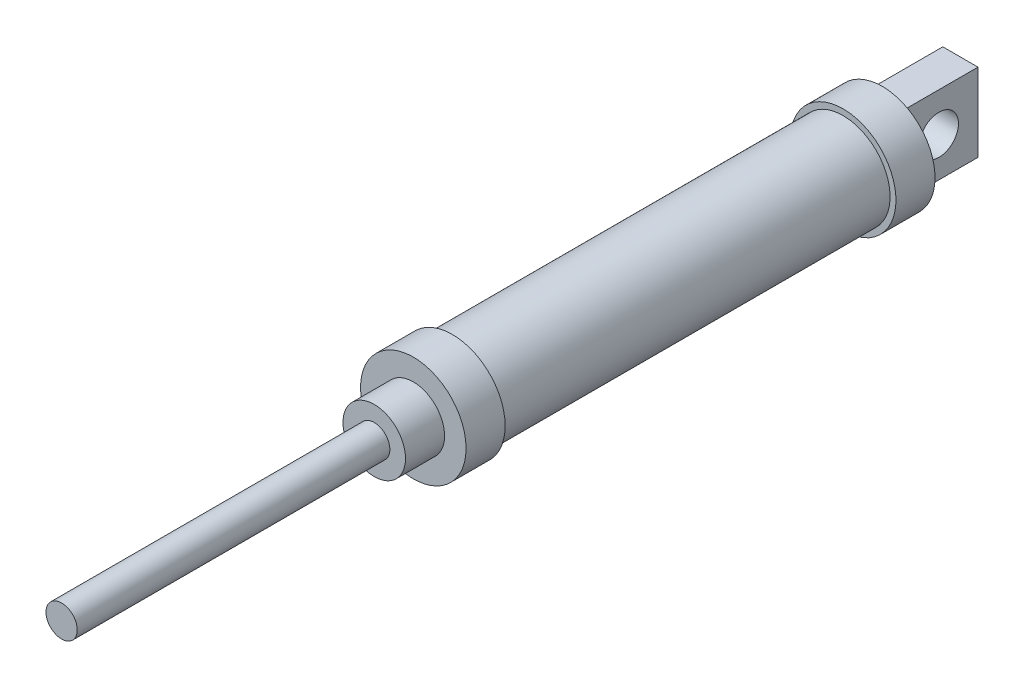
from build123d import *

# Parameters (mm, degrees)
SKETCH1_R           = 13.5
BOSS_EXTRUDE1_DEPTH = 10
SKETCH2_R           = 8
BOSS_EXTRUDE2_DEPTH = 10
SKETCH3_R           = 12
BOSS_EXTRUDE3_DEPTH = 100
BOSS_EXTRUDE4_START = 10
SKETCH4_R           = 13.5
BOSS_EXTRUDE4_DEPTH = 10
SKETCH5_W           = 9
SKETCH5_H           = 20
BOSS_EXTRUDE5_DEPTH = 20
SKETCH6_R           = 5
CUT_EXTRUDE1_DEPTH  = 20
SKETCH8_R           = 4
BOSS_EXTRUDE6_DEPTH = 80


with BuildPart() as part:
    # Sketch1 → Boss-Extrude1 (new body)
    with BuildSketch(Plane.XY):
        Circle(SKETCH1_R)
    extrude(amount=BOSS_EXTRUDE1_DEPTH)

    # Sketch2 → Boss-Extrude2 (add)
    with BuildSketch(Plane.XY.offset(10)):
        Circle(SKETCH2_R)
    extrude(amount=BOSS_EXTRUDE2_DEPTH)

    # Sketch3 → Boss-Extrude3 (add)
    with BuildSketch(Plane(origin=(0, 0, 0), x_dir=(-1, 0, 0), z_dir=(0, 0, -1))):
        Circle(SKETCH3_R)
    extrude(amount=BOSS_EXTRUDE3_DEPTH)

    # Sketch4 → Boss-Extrude4 (add)
    with BuildSketch(Plane(origin=(0, 0, -100), x_dir=(-1, 0, 0), z_dir=(0, 0, -1)).offset(BOSS_EXTRUDE4_START)):
        with Locations(Location((0, 0, 0), (0, 0, 180))):
            Circle(SKETCH4_R)
    extrude(amount=-BOSS_EXTRUDE4_DEPTH)

    # Sketch5 → Boss-Extrude5 (add)
    with BuildSketch(Plane(origin=(0, 0, -110), x_dir=(-1, 0, 0), z_dir=(0, 0, -1))):
        Rectangle(SKETCH5_W, SKETCH5_H)
    extrude(amount=BOSS_EXTRUDE5_DEPTH)

    # Sketch6 → Cut-Extrude1 (cut)
    with BuildSketch(Plane(origin=(4.5, 0, 0), x_dir=(0, 0, -1), z_dir=(1, 0, 0))):
        with Locations(Location((120, 0, 0), (0, 0, 90))):
            Circle(SKETCH6_R)
    extrude(amount=-CUT_EXTRUDE1_DEPTH, mode=Mode.SUBTRACT)

    # Sketch8 → Boss-Extrude6 (add)
    with BuildSketch(Plane.XY.offset(20)):
        Circle(SKETCH8_R)
    extrude(amount=BOSS_EXTRUDE6_DEPTH)


solid = part.part
